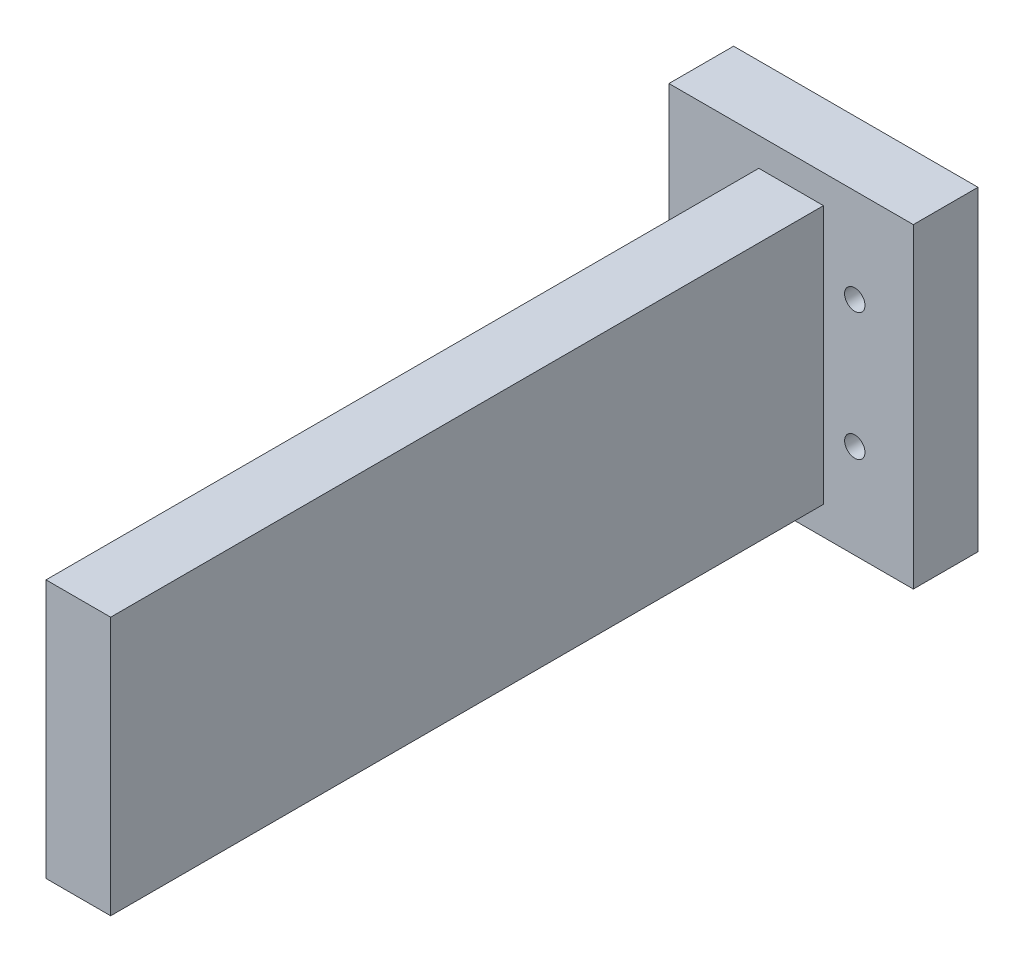
from build123d import *

# Parameters (mm, degrees)
CROQUIS1_W              = 48
CROQUIS1_H              = 62
CROQUIS1_R              = 1.996960485
CROQUIS1_R_2            = 2.003004462
CROQUIS1_R_3            = 2.010116485
CROQUIS1_R_4            = 1.995123233
SALIENTE_EXTRUIR1_DEPTH = 12.7
CROQUIS2_W              = 12.7
CROQUIS2_H              = 50.8
SALIENTE_EXTRUIR2_DEPTH = 140


with BuildPart() as part:
    # Croquis1 → Saliente-Extruir1 (new body)
    with BuildSketch(Plane.XY):
        Rectangle(CROQUIS1_W, CROQUIS1_H)
        with Locations((-12.5, 12.5)):
            Circle(CROQUIS1_R, mode=Mode.SUBTRACT)
        with Locations((12.5, 12.5)):
            Circle(CROQUIS1_R_2, mode=Mode.SUBTRACT)
        with Locations((-12.5, -12.5)):
            Circle(CROQUIS1_R_3, mode=Mode.SUBTRACT)
        with Locations((12.5, -12.5)):
            Circle(CROQUIS1_R_4, mode=Mode.SUBTRACT)
    extrude(amount=SALIENTE_EXTRUIR1_DEPTH)

    # Croquis2 → Saliente-Extruir2 (add)
    with BuildSketch(Plane.XY.offset(12.7)):
        Rectangle(CROQUIS2_W, CROQUIS2_H)
    extrude(amount=SALIENTE_EXTRUIR2_DEPTH)


solid = part.part
